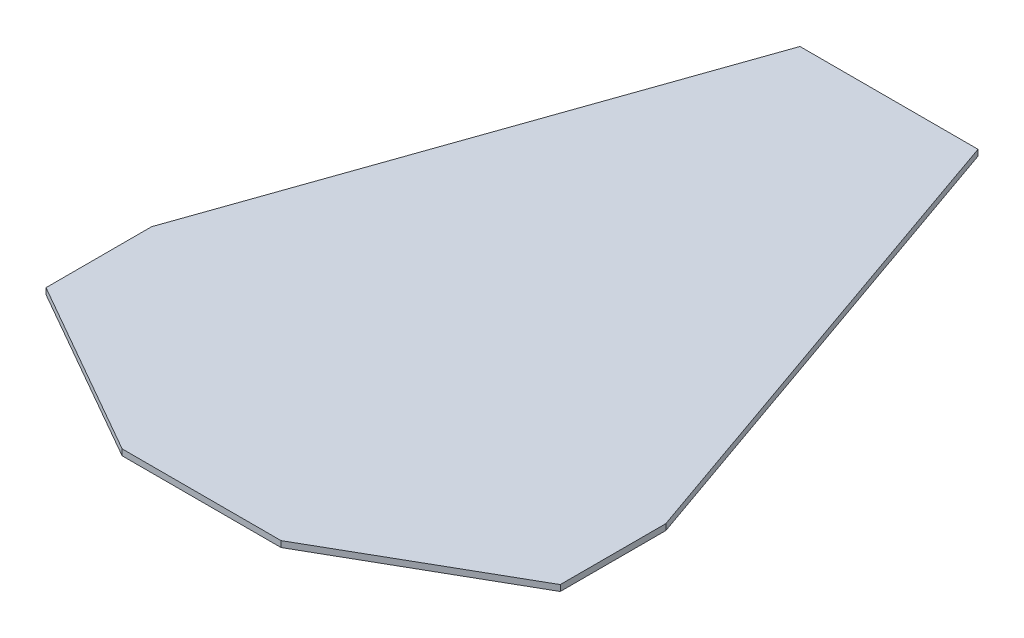
from build123d import *

# Parameters (mm, degrees)
BOSS_EXTRUDE1_DEPTH = 3.175


with BuildPart() as part:
    # Sketch1 → Boss-Extrude1 (new body)
    with BuildSketch(Plane(origin=(0, 0, 0), x_dir=(1, 0, 0), z_dir=(0, 1, 0))):
        Polygon((-6.727704382, 355.6), (-95.25, 102.679155377), (-95.25, 47.1149519), (-1.686334175, -6.35), (81.981447588, -6.35), (175.545113412, 47.1149519), (175.545113412, 102.679155377), (87.022817794, 355.6), align=None)
    extrude(amount=BOSS_EXTRUDE1_DEPTH)


solid = part.part
